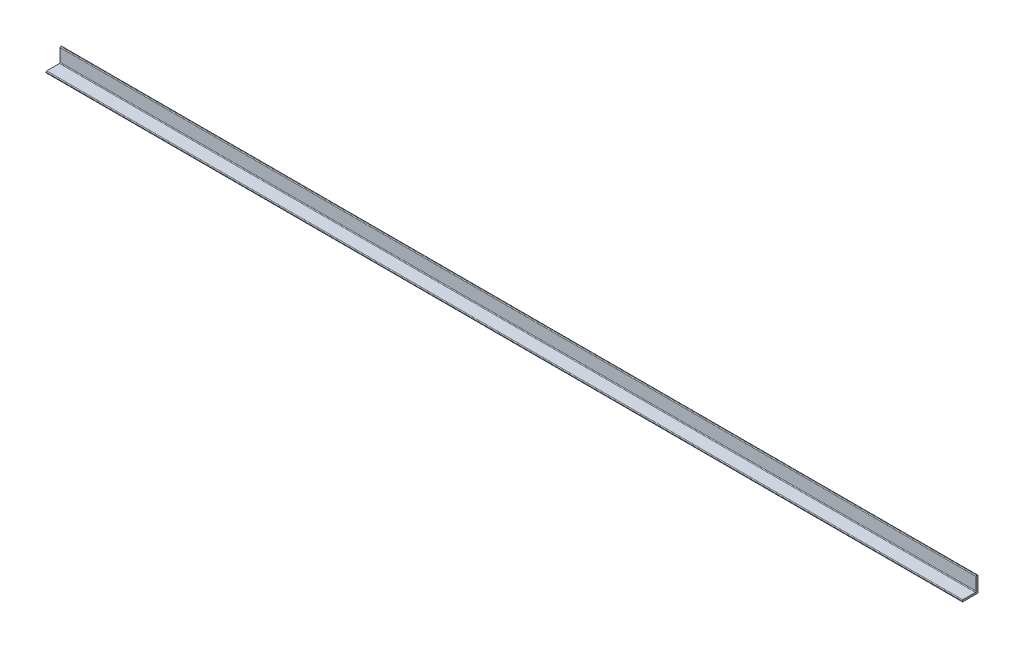
from build123d import *

# Parameters (mm, degrees)
SKETCH1_W           = 1300
SKETCH1_H           = 22.5
BOSS_EXTRUDE1_DEPTH = 2.5
SKETCH2_W           = 1300
SKETCH2_H           = 2.5
BOSS_EXTRUDE2_DEPTH = 20
FILLET1_R           = 1


with BuildPart() as part:
    # Sketch1 → Boss-Extrude1 (new body)
    with BuildSketch(Plane(origin=(0, 0, 0), x_dir=(1, 0, 0), z_dir=(0, 1, 0))):
        Rectangle(SKETCH1_W, SKETCH1_H)
    extrude(amount=BOSS_EXTRUDE1_DEPTH)

    # Sketch2 → Boss-Extrude2 (add)
    with BuildSketch(Plane(origin=(0, 2.5, 0), x_dir=(1, 0, 0), z_dir=(0, 1, 0))):
        with Locations((0, 10)):
            Rectangle(SKETCH2_W, SKETCH2_H)
    extrude(amount=BOSS_EXTRUDE2_DEPTH)

    # Fillet1
    fillet1_edges = [part.edges().sort_by_distance(p)[0] for p in [
        (0, 2.5, 11.25),
        (0, 2.5, -8.75),
        (0, 22.5, -8.75),
        (0, 22.5, -11.25),
        (0, 0, 11.25),
        (0, 0, -11.25),
    ]]
    fillet(fillet1_edges, radius=FILLET1_R)


solid = part.part
